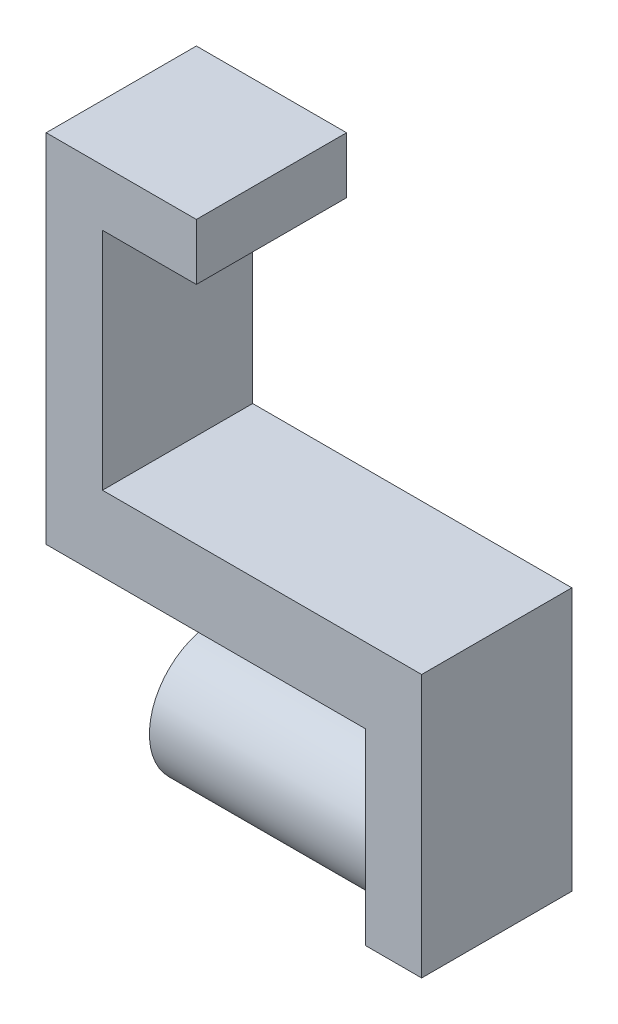
from build123d import *

# Parameters (mm, degrees)
SKETCH1_R                = 11.1125
BOSS_EXTRUDE1_DEPTH      = 38.1
BOSS_EXTRUDE2_DEPTH      = 12.7
BOSS_EXTRUDE2_DEPTH_BACK = 12.7
SKETCH2_W                = 9.525
SKETCH2_H                = 31.75
BOSS_EXTRUDE3_DEPTH      = 12.7
BOSS_EXTRUDE3_DEPTH_BACK = 12.7
SKETCH3_W                = 63.5
SKETCH3_H                = 12.7
BOSS_EXTRUDE4_DEPTH      = 12.7
BOSS_EXTRUDE4_DEPTH_BACK = 12.7
SKETCH4_W                = 9.525
SKETCH4_H                = 60.2996
BOSS_EXTRUDE5_DEPTH      = 12.7
BOSS_EXTRUDE5_DEPTH_BACK = 12.7
SKETCH5_W                = 25.4
SKETCH5_H                = 9.525


with BuildPart() as part:
    # Sketch1 → Boss-Extrude1 (new body)
    with BuildSketch(Plane(origin=(0, 0, 0), x_dir=(0, 0, -1), z_dir=(1, 0, 0))):
        Circle(SKETCH1_R)
    extrude(amount=-BOSS_EXTRUDE1_DEPTH)

    # Sketch2 → Boss-Extrude2 (add, two sides: drawn at the far end of the back side and taken through both)
    with BuildSketch(Plane.XY.offset(-BOSS_EXTRUDE2_DEPTH_BACK)):
        with Locations((4.7625, 4.7625)):
            Rectangle(SKETCH2_W, SKETCH2_H)
    extrude(amount=BOSS_EXTRUDE2_DEPTH + BOSS_EXTRUDE2_DEPTH_BACK)

    # Sketch3 → Boss-Extrude3 (add, two sides: drawn at the far end of the back side and taken through both)
    with BuildSketch(Plane.XY.offset(-BOSS_EXTRUDE3_DEPTH_BACK)):
        with Locations((-22.225, 26.9875)):
            Rectangle(SKETCH3_W, SKETCH3_H)
    extrude(amount=BOSS_EXTRUDE3_DEPTH + BOSS_EXTRUDE3_DEPTH_BACK)

    # Sketch4 → Boss-Extrude4 (add, two sides: drawn at the far end of the back side and taken through both)
    with BuildSketch(Plane.XY.offset(-BOSS_EXTRUDE4_DEPTH_BACK)):
        with Locations((-49.2125, 50.7873)):
            Rectangle(SKETCH4_W, SKETCH4_H)
    extrude(amount=BOSS_EXTRUDE4_DEPTH + BOSS_EXTRUDE4_DEPTH_BACK)

    # Sketch5 → Boss-Extrude5 (add, two sides: drawn at the far end of the back side and taken through both)
    with BuildSketch(Plane.XY.offset(-BOSS_EXTRUDE5_DEPTH_BACK)):
        with Locations((-41.275, 76.1746)):
            Rectangle(SKETCH5_W, SKETCH5_H)
    extrude(amount=BOSS_EXTRUDE5_DEPTH + BOSS_EXTRUDE5_DEPTH_BACK)


solid = part.part
